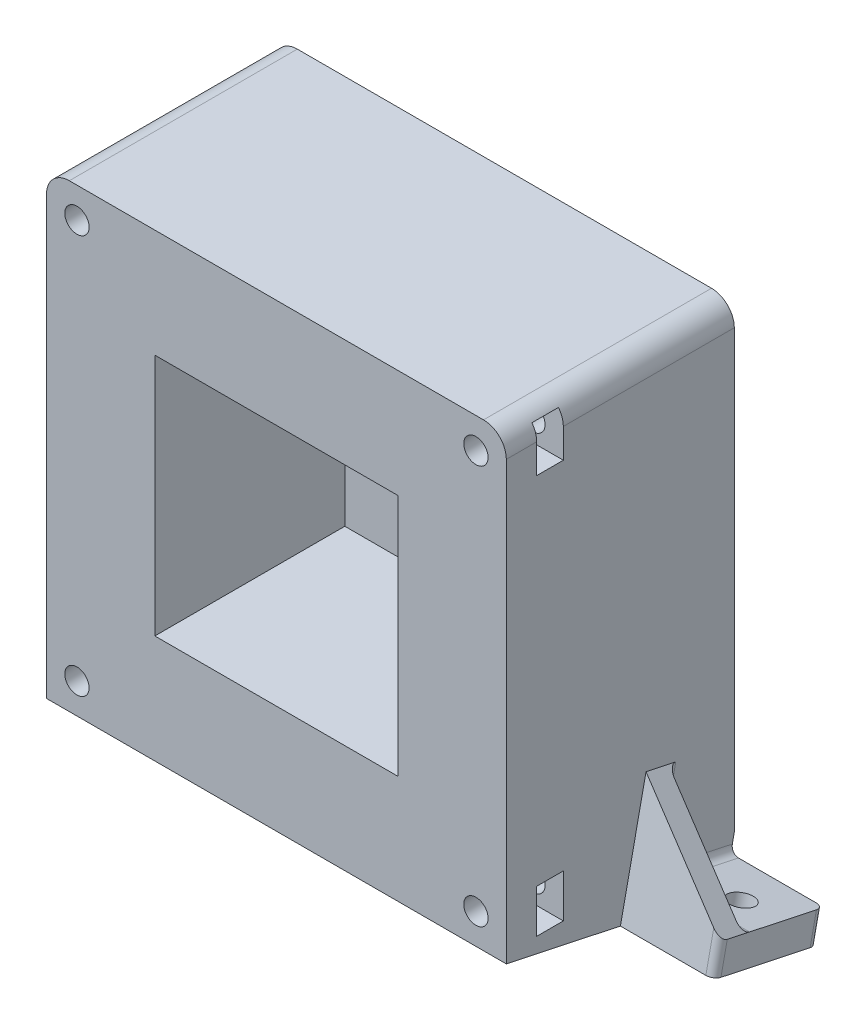
from build123d import *

# Parameters (mm, degrees)
SKETCH_1_R          = 1.6
SKETCH_1_W          = 32
SKETCH_1_H          = 32
EXTRUDE_1_DEPTH     = 30
SKETCH_3_W          = 32
SKETCH_3_H          = 32
EXTRUDE_2_DEPTH     = 5
SKETCH_4_R          = 6.35
CUT_EXTRUDE_1_DEPTH = 53.250598083
SKETCH_5_R          = 10
CUT_EXTRUDE_2_DEPTH = 3
CUT_EXTRUDE_3_DEPTH = 3.5
EXTRUDE_3_DEPTH     = 60.5
SKETCH_14_W         = 12.25
SKETCH_14_H         = 14
SKETCH_14_R         = 1.6
EXTRUDE_4_DEPTH     = 4
EXTRUDE_5_DEPTH     = 3
FILLET_1_R          = 1


with BuildPart() as part:
    # ｽｹｯﾁ1 → ﾎﾞｽ - 押し出し1 (new body)
    with BuildSketch(Plane.XY):
        with BuildLine():
            Line((30.25, -30.25), (30.25, 27.25))
            ThreePointArc((30.25, 27.25), (29.371320344, 29.371320344), (27.25, 30.25))
            Line((27.25, 30.25), (-27.25, 30.25))
            ThreePointArc((-27.25, 30.25), (-29.371320344, 29.371320344), (-30.25, 27.25))
            Line((-30.25, 27.25), (-30.25, -30.25))
            Line((-30.25, -30.25), (30.25, -30.25))
        make_face()
        with Locations((-26.25, 26.25)):
            Circle(SKETCH_1_R, mode=Mode.SUBTRACT)
        with Locations((-26.25, -26.25)):
            Circle(SKETCH_1_R, mode=Mode.SUBTRACT)
        with Locations((26.25, -26.25)):
            Circle(SKETCH_1_R, mode=Mode.SUBTRACT)
        with Locations((26.25, 26.25)):
            Circle(SKETCH_1_R, mode=Mode.SUBTRACT)
        Rectangle(SKETCH_1_W, SKETCH_1_H, mode=Mode.SUBTRACT)
    extrude(amount=-EXTRUDE_1_DEPTH)

    # ｽｹｯﾁ3 → ﾎﾞｽ - 押し出し2 (add)
    with BuildSketch(Plane(origin=(0, 0, -30), x_dir=(-1, 0, 0), z_dir=(0, 0, -1))):
        Rectangle(SKETCH_3_W, SKETCH_3_H)
    extrude(amount=-EXTRUDE_2_DEPTH)

    # ｽｹｯﾁ4 → ｶｯﾄ - 押し出し1 (cut, through all)
    with BuildSketch(Plane(origin=(0, 0, -30), x_dir=(-1, 0, 0), z_dir=(0, 0, -1))):
        Circle(SKETCH_4_R)
    extrude(amount=-CUT_EXTRUDE_1_DEPTH, mode=Mode.SUBTRACT)

    # ｽｹｯﾁ5 → ｶｯﾄ - 押し出し2 (cut)
    with BuildSketch(Plane.XY.offset(-25)):
        Circle(SKETCH_5_R)
    extrude(amount=-CUT_EXTRUDE_2_DEPTH, mode=Mode.SUBTRACT)

    # ｽｹｯﾁ10 → ｶｯﾄ - 押し出し3 (cut)
    with BuildSketch(Plane.XY.offset(-4)):
        Polygon((27.895448267, -23.4), (30.25, -23.4), (30.25, -29.1), (27.895448267, -29.1), (24.604551733, -29.1), (22.959103466, -26.25), (24.604551733, -23.4), align=None)
        Polygon((-30.25, -29.1), (-27.895448267, -29.1), (-24.604551733, -29.1), (-22.959103466, -26.25), (-24.604551733, -23.4), (-27.895448267, -23.4), (-30.25, -23.4), align=None)
        Polygon((-27.895448267, 23.4), (-30.25, 23.4), (-30.25, 29.1), (-27.895448267, 29.1), (-24.604551733, 29.1), (-22.959103466, 26.25), (-24.604551733, 23.4), align=None)
        Polygon((30.25, 29.1), (27.895448267, 29.1), (24.604551733, 29.1), (22.959103466, 26.25), (24.604551733, 23.4), (27.895448267, 23.4), (30.25, 23.4), align=None)
    extrude(amount=-CUT_EXTRUDE_3_DEPTH, mode=Mode.SUBTRACT)

    # ｽｹｯﾁ13 → ﾎﾞｽ - 押し出し3 (add)
    with BuildSketch(Plane.ZY.offset(30.25)):
        Polygon((-30, -30.25), (-28.703181865, -36.351049646), (0, -30.25), align=None)
    extrude(amount=-EXTRUDE_3_DEPTH)

    # ｽｹｯﾁ14 → ﾎﾞｽ - 押し出し4 (add)
    with BuildSketch(Plane(origin=(0, -28.942375047, 6.151891727), x_dir=(1, 0, 0), z_dir=(0, -0.9781476007338057, 0.20791169081775968))):
        with Locations((-36.375, -28.633756669)):
            Rectangle(SKETCH_14_W, SKETCH_14_H)
        with Locations(Location((-37.5, -29.633756669, 0), (0, 0, 270))):
            Circle(SKETCH_14_R, mode=Mode.SUBTRACT)
    extrude_4 = extrude(amount=-EXTRUDE_4_DEPTH)

    # ｽｹｯﾁ16 → ﾎﾞｽ - 押し出し5 (add)
    with BuildSketch(Plane(origin=(0, -4.497910928, -21.161007181), x_dir=(1, 0, 0), z_dir=(0, 0.20791169081775962, 0.9781476007338056))):
        Polygon((-42.5, -25.588964922), (-30.25, -13.338964922), (-30.25, -25.588964922), align=None)
    extrude_5 = extrude(amount=-EXTRUDE_5_DEPTH)

    # ﾐﾗｰ1: ﾎﾞｽ - 押し出し4, ﾎﾞｽ - 押し出し5 across plane
    add(extrude_4.mirror(Plane(origin=(0, 0, 0), x_dir=(0, 0, 1), z_dir=(1, 0, 0))))
    add(extrude_5.mirror(Plane(origin=(0, 0, 0), x_dir=(0, 0, 1), z_dir=(1, 0, 0))))

    # ﾌｨﾚｯﾄ1
    fillet_1_edges = [part.edges().sort_by_distance(p)[0] for p in [
        (-30.25, -31.294944944, -24.155016824),
        (-42.5, -34.394754445, -29.119005246),
        (-42.5, -31.483990773, -15.424938836),
        (-36.375, -30.151430644, -18.77520502),
        (-30.25, -24.16027659, -20.048664126),
        (30.25, -31.294944944, -24.155016824),
        (42.5, -31.483990773, -15.424938836),
        (42.5, -34.394754445, -29.119005246),
        (36.375, -30.151430644, -18.77520502),
        (30.25, -24.16027659, -20.048664126),
    ]]
    fillet(fillet_1_edges, radius=FILLET_1_R)


solid = part.part
